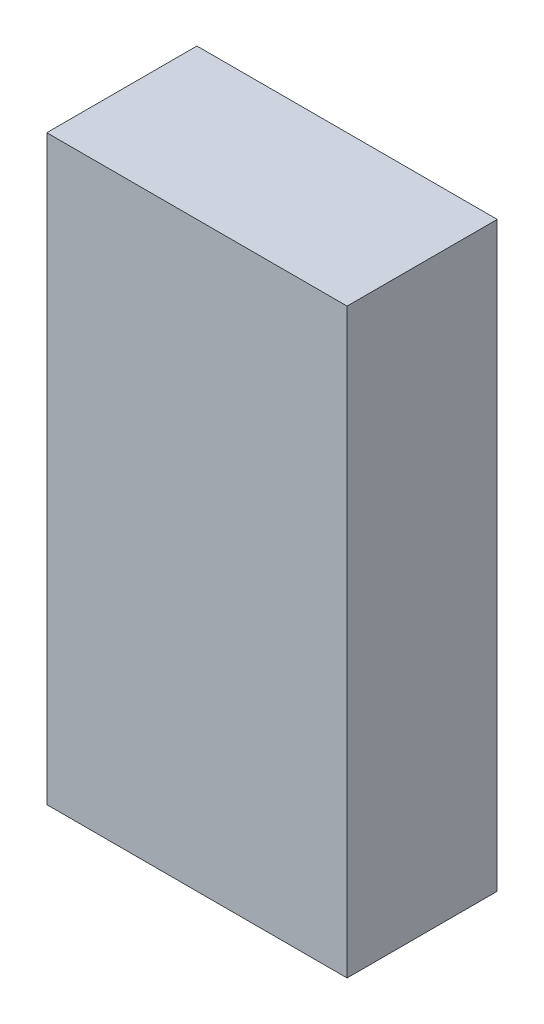
from build123d import *

# Parameters (mm, degrees)
SKETCH2_W           = 50.8
SKETCH2_H           = 25.4
BOSS_EXTRUDE1_DEPTH = 98.425
SKETCH4_R           = 2.667
CUT_EXTRUDE2_DEPTH  = 19.05
SKETCH5_R           = 4.826
CUT_EXTRUDE3_DEPTH  = 12.7


with BuildPart() as part:
    # Sketch2 → Boss-Extrude1 (new body)
    with BuildSketch(Plane(origin=(0, 0, 0), x_dir=(1, 0, 0), z_dir=(0, 1, 0))):
        with Locations((25.4, 12.7)):
            Rectangle(SKETCH2_W, SKETCH2_H)
    extrude(amount=BOSS_EXTRUDE1_DEPTH)

    # Sketch4 → Cut-Extrude2 (cut)
    with BuildSketch(Plane(origin=(0, 0, 0), x_dir=(-1, 0, 0), z_dir=(0, -1, 0))):
        with Locations(Location((-12.7, 12.7, 0), (0, 0, 90))):
            Circle(SKETCH4_R)
        with Locations(Location((-38.1, 12.7, 0), (0, 0, 90))):
            Circle(SKETCH4_R)
    extrude(amount=-CUT_EXTRUDE2_DEPTH, mode=Mode.SUBTRACT)

    # Sketch5 → Cut-Extrude3 (cut)
    with BuildSketch(Plane(origin=(0, 0, -25.4), x_dir=(-1, 0, 0), z_dir=(0, 0, -1))):
        with Locations((-25.4, 85.725)):
            Circle(SKETCH5_R)
    extrude(amount=-CUT_EXTRUDE3_DEPTH, mode=Mode.SUBTRACT)


solid = part.part
